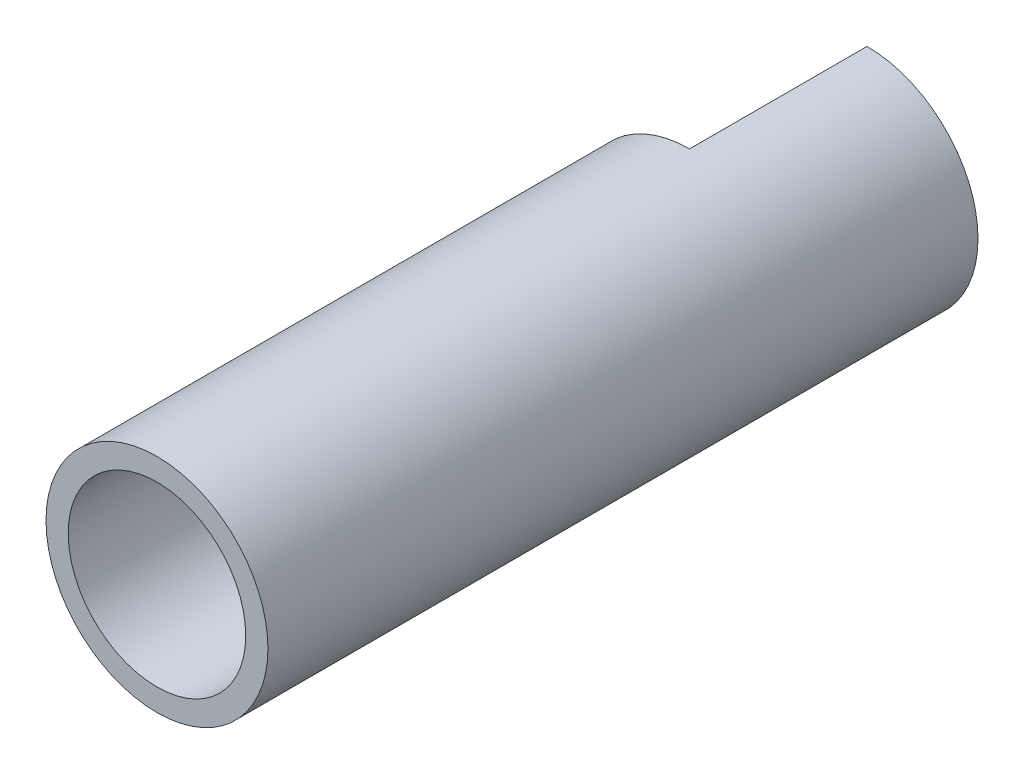
from build123d import *

# Parameters (mm, degrees)
SKETCH1_R           = 31.75
SKETCH1_R_2         = 25.4
BOSS_EXTRUDE1_DEPTH = 203.2
CUT_EXTRUDE1_REACH  = 210.102
SKETCH2_W           = 50.8
SKETCH2_H           = 63.5


with BuildPart() as part:
    # Sketch1 → Boss-Extrude1 (new body)
    with BuildSketch(Plane.XY):
        Circle(SKETCH1_R)
        Circle(SKETCH1_R_2, mode=Mode.SUBTRACT)
    extrude(amount=BOSS_EXTRUDE1_DEPTH)

    # Sketch2 → Cut-Extrude1 (cut, up to next)
    with BuildSketch(Plane(origin=(0, 0, 0), x_dir=(0, 0, -1), z_dir=(1, 0, 0)), mode=Mode.PRIVATE) as cut_extrude1_sk1:
        with Locations((-25.4, 0)):
            Rectangle(SKETCH2_W, SKETCH2_H)
    cut_extrude1_tool1 = extrude(cut_extrude1_sk1.sketch, amount=-CUT_EXTRUDE1_REACH, mode=Mode.PRIVATE) & part.part
    add(cut_extrude1_tool1.solids().sort_by_distance((0, 0, 25.4))[0], mode=Mode.SUBTRACT)


solid = part.part
